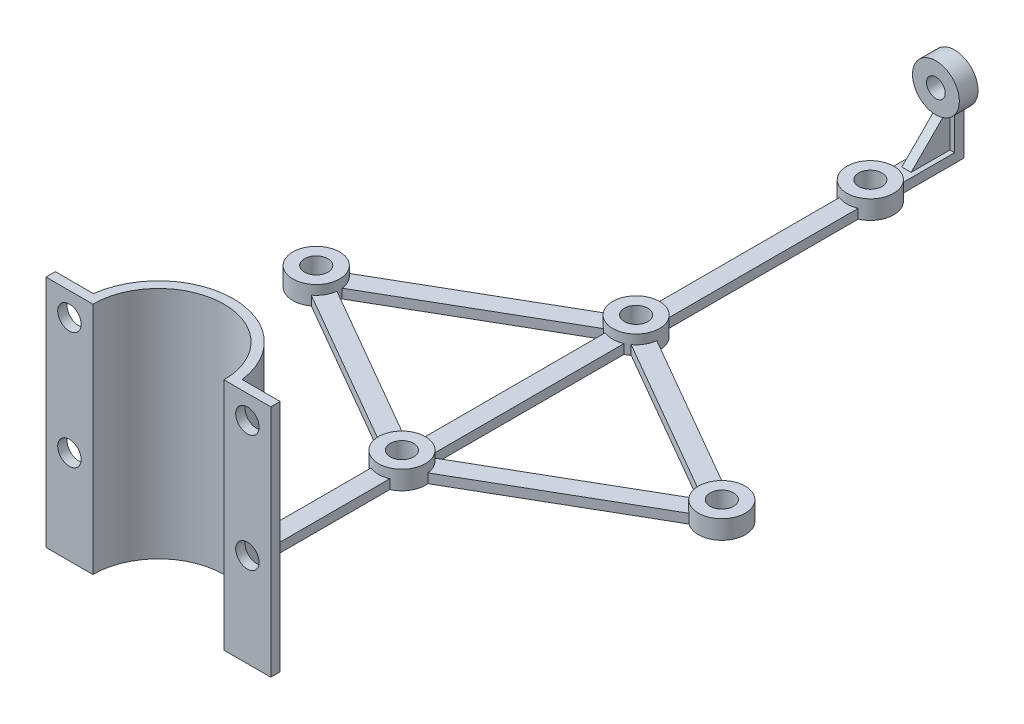
from build123d import *

# Parameters (mm, degrees)
EXTRUDE_1_DEPTH     = 50
SKETCH_2_R          = 2.5
CUT_EXTRUDE_1_DEPTH = 58.723478759
SKETCH_3_W          = 4
SKETCH_3_H          = 154
EXTRUDE_2_DEPTH     = 2
SKETCH_4_R          = 5
EXTRUDE_3_DEPTH     = 4
SKETCH_9_R          = 5
EXTRUDE_7_DEPTH     = 4
EXTRUDE_7_2_DEPTH   = 4
EXTRUDE_8_DEPTH     = 2
SKETCH_5_R          = 2.5
CUT_EXTRUDE_3_DEPTH = 182.815875825
SKETCH_11_W         = 4
SKETCH_11_H         = 2
EXTRUDE_9_DEPTH     = 10
SKETCH_12_R         = 5
EXTRUDE_10_DEPTH    = 4
CUT_EXTRUDE_4_REACH = 185.665
SKETCH_13_R         = 2
RIB_2_REACH         = 185.665
SKETCH_15_WALL_W    = 378.061306134
SKETCH_15_WALL_H    = 2
RIB_7_REACH         = 185.665
SKETCH_16_WALL_W    = 379.053421602
SKETCH_16_WALL_H    = 2


with BuildPart() as part:
    # Эскиз1 → Бобышка-Вытянуть1 (new body)
    with BuildSketch(Plane(origin=(0, 0, 0), x_dir=(1, 0, 0), z_dir=(0, 1, 0))):
        with BuildLine():
            Line((-14, 0), (-24, 0))
            Line((-24, 0), (-24, 2))
            Line((-24, 2), (-15.874507866, 2))
            ThreePointArc((-15.874507866, 2), (0, 16), (15.874507866, 2))
            Line((15.874507866, 2), (24, 2))
            Line((24, 2), (24, 0))
            Line((24, 0), (14, 0))
            ThreePointArc((14, 0), (0, 14), (-14, 0))
        make_face()
    extrude(amount=EXTRUDE_1_DEPTH)

    # Эскиз2 → Вырез-Вытянуть1 (cut, through all)
    with BuildSketch(Plane.XY):
        with Locations((-19, 45)):
            Circle(SKETCH_2_R)
        with Locations((-19, 20)):
            Circle(SKETCH_2_R)
    cut_extrude_1 = extrude(amount=-CUT_EXTRUDE_1_DEPTH, mode=Mode.SUBTRACT)

    # Зеркальное отражение1: Вырез-Вытянуть1 across plane
    add(cut_extrude_1.mirror(Plane(origin=(0, 0, 0), x_dir=(0, 0, 1), z_dir=(1, 0, 0))), mode=Mode.SUBTRACT)

    # Эскиз3 → Бобышка-Вытянуть2 (add)
    with BuildSketch(Plane(origin=(0, 0, 0), x_dir=(1, 0, 0), z_dir=(0, 1, 0))):
        with Locations((0, 91)):
            Rectangle(SKETCH_3_W, SKETCH_3_H)
    extrude(amount=EXTRUDE_2_DEPTH)

    # Эскиз4 → Бобышка-Вытянуть3 (add)
    with BuildSketch(Plane(origin=(0, 0, 0), x_dir=(1, 0, 0), z_dir=(0, 1, 0))):
        with Locations(Location((0, 52, 0), (0, 0, 113.578178478))):
            Circle(SKETCH_4_R)
        with Locations(Location((0, 102, 0), (0, 0, 66.421821522))):
            Circle(SKETCH_4_R)
        with Locations(Location((0, 152, 0), (0, 0, 66.421821522))):
            Circle(SKETCH_4_R)
    extrude(amount=EXTRUDE_3_DEPTH)



with BuildPart() as body_2:
    # Эскиз9 → Бобышка-Вытянуть7 (new body)
    with BuildSketch(Plane(origin=(0, 0, 0), x_dir=(1, 0, 0), z_dir=(0, 1, 0))):
        with Locations(Location((-43.301270189, 77, 0), (0, 0, 270))):
            Circle(SKETCH_9_R)
    extrude(amount=EXTRUDE_7_DEPTH)


with BuildPart() as body_3:
    # Эскиз9 → Extrude 7 2 (new body)
    with BuildSketch(Plane(origin=(0, 0, 0), x_dir=(1, 0, 0), z_dir=(0, 1, 0))):
        with Locations(Location((43.301270189, 77, 0), (0, 0, 90))):
            Circle(SKETCH_9_R)
    extrude(amount=EXTRUDE_7_2_DEPTH)


with BuildPart() as part_1:
    add(part.part)

    add(body_2.part)  # Бобышка-Вытянуть8 merges body 2

    add(body_3.part)  # Бобышка-Вытянуть8 merges body 3
    # Эскиз10 → Бобышка-Вытянуть8 (add)
    with BuildSketch(Plane(origin=(0, 0, 0), x_dir=(1, 0, 0), z_dir=(0, 1, 0))):
        Polygon((0, 104.309401077), (-47.301270189, 77), (0, 49.690598923), (47.301270189, 77), align=None)
        Polygon((0, 99.690598923), (-39.301270189, 77), (0, 54.309401077), (39.301270189, 77), align=None, mode=Mode.SUBTRACT)
    extrude(amount=EXTRUDE_8_DEPTH)

    # Эскиз5 → Вырез-Вытянуть3 (cut, through all)
    with BuildSketch(Plane(origin=(0, 0, 0), x_dir=(1, 0, 0), z_dir=(0, 1, 0))):
        with Locations(Location((0, 102, 0), (0, 0, 270))):
            Circle(SKETCH_5_R)
        with Locations(Location((0, 52, 0), (0, 0, 270))):
            Circle(SKETCH_5_R)
        with Locations(Location((0, 152, 0), (0, 0, 270))):
            Circle(SKETCH_5_R)
        with Locations(Location((-43.301270189, 77, 0), (0, 0, 270))):
            Circle(SKETCH_5_R)
        with Locations(Location((43.301270189, 77, 0), (0, 0, 90))):
            Circle(SKETCH_5_R)
    extrude(amount=CUT_EXTRUDE_3_DEPTH, mode=Mode.SUBTRACT)

    # Эскиз11 → Бобышка-Вытянуть9 (add)
    with BuildSketch(Plane(origin=(0, 0, 0), x_dir=(1, 0, 0), z_dir=(0, 1, 0))):
        with Locations((0, 169)):
            Rectangle(SKETCH_11_W, SKETCH_11_H)
    extrude(amount=EXTRUDE_9_DEPTH)

    # Эскиз12 → Бобышка-Вытянуть10 (add)
    with BuildSketch(Plane(origin=(0, 0, -170), x_dir=(-1, 0, 0), z_dir=(0, 0, -1))):
        with Locations((0, 14)):
            Circle(SKETCH_12_R)
    extrude(amount=-EXTRUDE_10_DEPTH)

    # Эскиз13 → Вырез-Вытянуть4 (cut, up to next)
    with BuildSketch(Plane(origin=(0, 0, -170), x_dir=(-1, 0, 0), z_dir=(0, 0, -1)), mode=Mode.PRIVATE) as cut_extrude_4_sk1:
        with Locations((0, 14)):
            Circle(SKETCH_13_R)
    cut_extrude_4_tool1 = extrude(cut_extrude_4_sk1.sketch, amount=-CUT_EXTRUDE_4_REACH, mode=Mode.PRIVATE) & part_1.part
    add(cut_extrude_4_tool1.solids().sort_by_distance((0, 14, -170))[0], mode=Mode.SUBTRACT)

    # Эскиз15 wall → Ребро2 (add, up to next)
    with BuildSketch(Plane(origin=(0, 5.650617497, -163.373503951), x_dir=(0, -0.707106781187, 0.707106781187), z_dir=(0, -0.707106781187, -0.707106781187)), mode=Mode.PRIVATE) as rib_2_sk1:
        Rectangle(SKETCH_15_WALL_W, SKETCH_15_WALL_H)
    rib_2_tool1 = extrude(rib_2_sk1.sketch, amount=RIB_2_REACH, mode=Mode.PRIVATE) - part_1.part
    add(rib_2_tool1.solids().sort_by_distance((0, 5.650617497, -163.373503951))[0])

    # Эскиз16 wall → Ребро7 (add, up to next)
    with BuildSketch(Plane(origin=(0, 6.071182812, -19.696276491), x_dir=(0, -0.707106781187, -0.707106781187), z_dir=(0, 0.707106781187, -0.707106781187)), mode=Mode.PRIVATE) as rib_7_sk1:
        Rectangle(SKETCH_16_WALL_W, SKETCH_16_WALL_H)
    rib_7_tool1 = extrude(rib_7_sk1.sketch, amount=-RIB_7_REACH, mode=Mode.PRIVATE) - part_1.part
    add(rib_7_tool1.solids().sort_by_distance((0, 6.071182812, -19.696276491))[0])


solid = part_1.part
